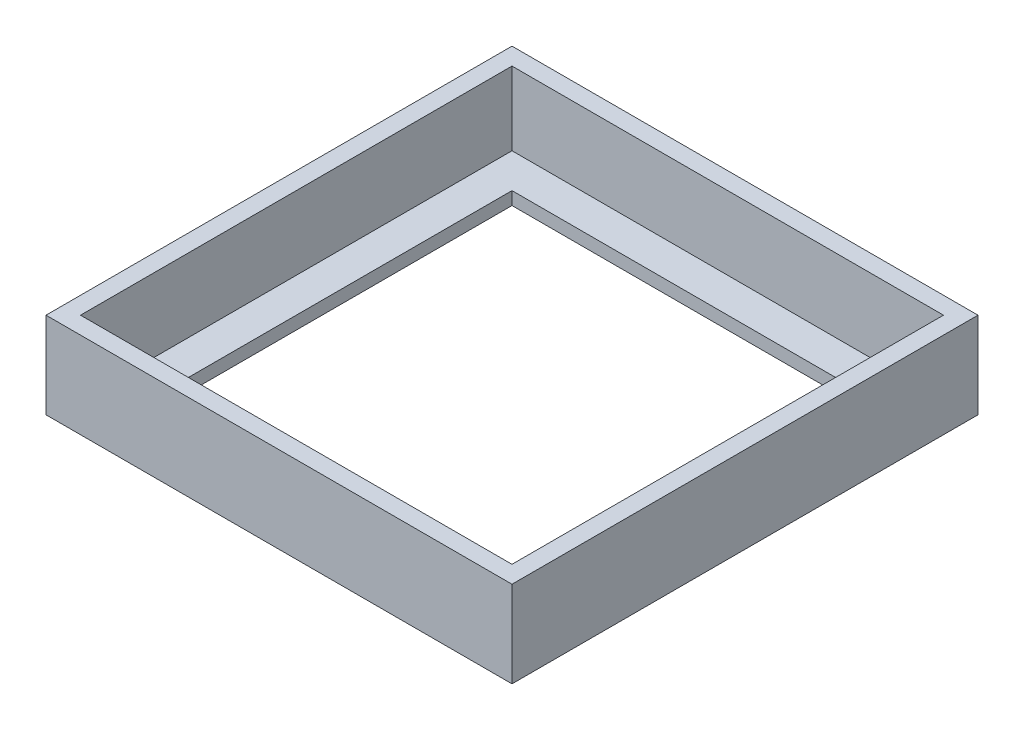
from build123d import *

# Parameters (mm, degrees)
SKETCH1_W           = 50
SKETCH1_H           = 50
SKETCH1_W_2         = 42
SKETCH1_H_2         = 42
BOSS_EXTRUDE8_DEPTH = 1.5
SKETCH1_19_W        = 54
SKETCH1_19_H        = 54
SKETCH1_19_W_2      = 50
SKETCH1_19_H_2      = 50
BOSS_EXTRUDE9_DEPTH = 10


with BuildPart() as part:
    # Sketch1 → Boss-Extrude8 (new body)
    with BuildSketch(Plane(origin=(0, 0, 0), x_dir=(1, 0, 0), z_dir=(0, 1, 0))):
        with Locations((-19, 6)):
            Rectangle(SKETCH1_W, SKETCH1_H)
        with Locations((-19, 6)):
            Rectangle(SKETCH1_W_2, SKETCH1_H_2, mode=Mode.SUBTRACT)
    extrude(amount=BOSS_EXTRUDE8_DEPTH)

    # Sketch1<19> → Boss-Extrude9 (add)
    with BuildSketch(Plane(origin=(0, 0, 0), x_dir=(1, 0, 0), z_dir=(0, 1, 0))):
        with Locations((-19, 6)):
            Rectangle(SKETCH1_19_W, SKETCH1_19_H)
        with Locations((-19, 6)):
            Rectangle(SKETCH1_19_W_2, SKETCH1_19_H_2, mode=Mode.SUBTRACT)
    extrude(amount=BOSS_EXTRUDE9_DEPTH)


solid = part.part
